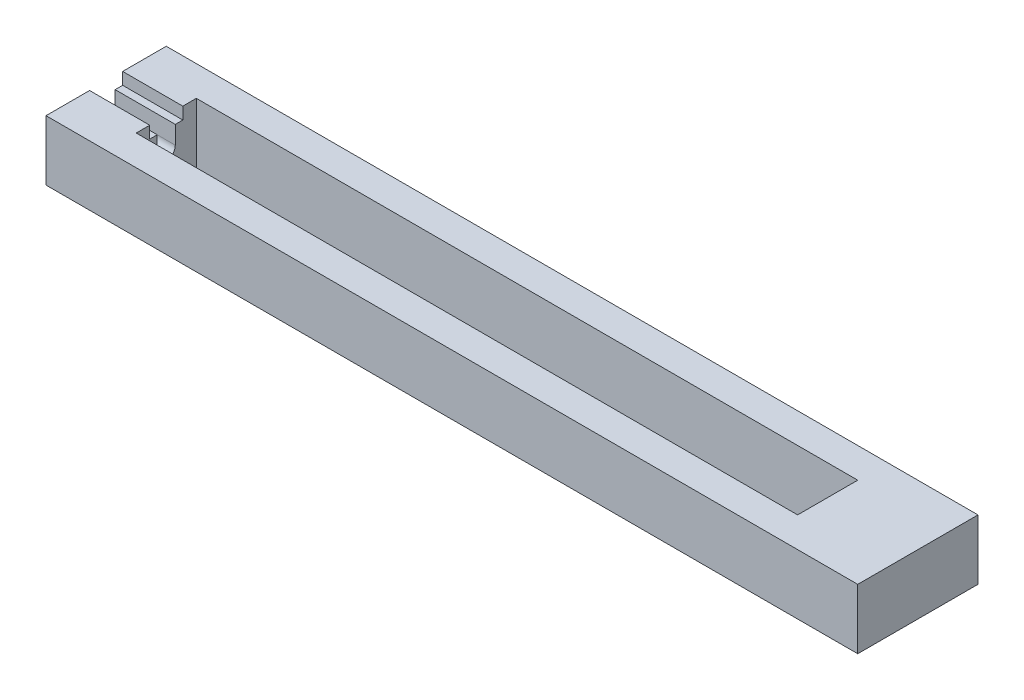
from build123d import *

# Parameters (mm, degrees)
SKETCH1_W           = 13.5
SKETCH1_H           = 2
SKETCH1_W_2         = 11
SKETCH1_H_2         = 1
BOSS_EXTRUDE1_DEPTH = 1
CUT_EXTRUDE2_DEPTH  = 1


with BuildPart() as part:
    # Sketch1 → Boss-Extrude1 (new body)
    with BuildSketch(Plane(origin=(0, 0, 0), x_dir=(1, 0, 0), z_dir=(0, 1, 0))):
        Rectangle(SKETCH1_W, SKETCH1_H)
        with Locations((-0.25, 0)):
            Rectangle(SKETCH1_W_2, SKETCH1_H_2, mode=Mode.SUBTRACT)
    extrude(amount=BOSS_EXTRUDE1_DEPTH)

    # Sketch2 → Cut-Extrude2 (cut)
    with BuildSketch(Plane.ZY.offset(6.75)):
        with BuildLine():
            Line((0.15, 0.5), (0.15, 0.8))
            Line((0.15, 0.8), (0.275, 0.8))
            Line((0.275, 0.8), (0.275, 1))
            Line((0.275, 1), (0.15, 1))
            Line((0.15, 1), (-0.15, 1))
            Line((-0.15, 1), (-0.275, 1))
            Line((-0.275, 1), (-0.275, 0.8))
            Line((-0.275, 0.8), (-0.15, 0.8))
            Line((-0.15, 0.8), (-0.15, 0.5))
            ThreePointArc((-0.15, 0.5), (0, 0.35), (0.15, 0.5))
        make_face()
    extrude(amount=-CUT_EXTRUDE2_DEPTH, mode=Mode.SUBTRACT)


solid = part.part
